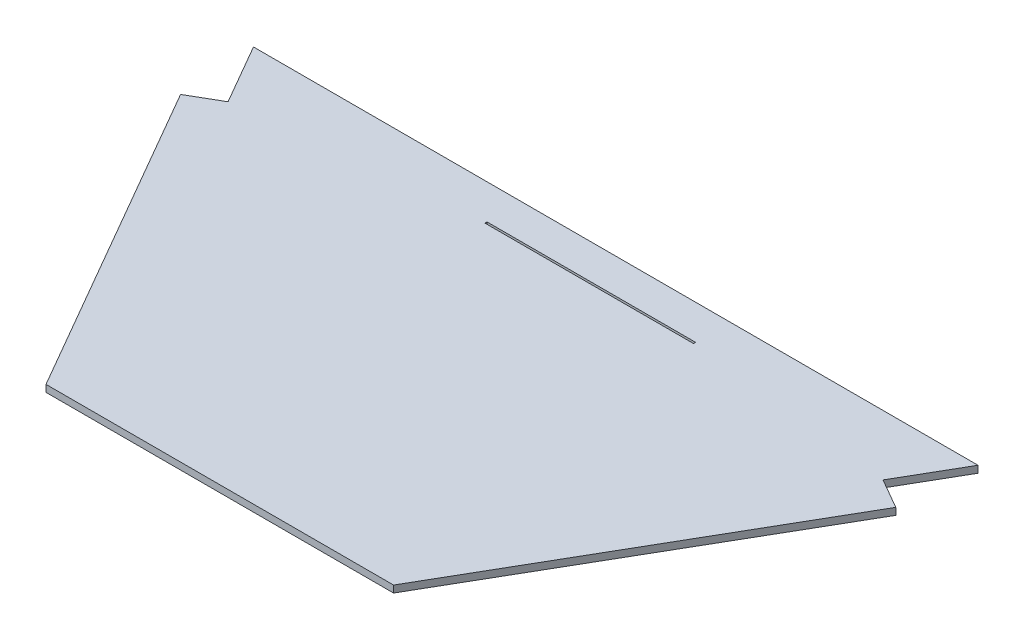
from build123d import *

# Parameters (mm, degrees)
BOSS_EXTRUDE1_DEPTH = 10
SKETCH2_W           = 300
SKETCH2_H           = 3
CUT_EXTRUDE1_DEPTH  = 959.755029562


with BuildPart() as part:
    # Sketch1 → Boss-Extrude1 (new body)
    with BuildSketch(Plane(origin=(0, 0, 0), x_dir=(1, 0, 0), z_dir=(0, 1, 0))):
        Polygon((-271.133729811, 569.617395678), (771.133729811, 569.617395678), (721.133729811, 483.014855299), (764.435, 458.014855299), (500, 0), (0, 0), (-264.435, 458.014855299), (-221.133729811, 483.014855299), align=None)
    extrude(amount=BOSS_EXTRUDE1_DEPTH)

    # Sketch2 → Cut-Extrude1 (cut, through all)
    with BuildSketch(Plane.XZ):
        with Locations((264.88, -518.12)):
            Rectangle(SKETCH2_W, SKETCH2_H)
    extrude(amount=-CUT_EXTRUDE1_DEPTH, mode=Mode.SUBTRACT)


solid = part.part
